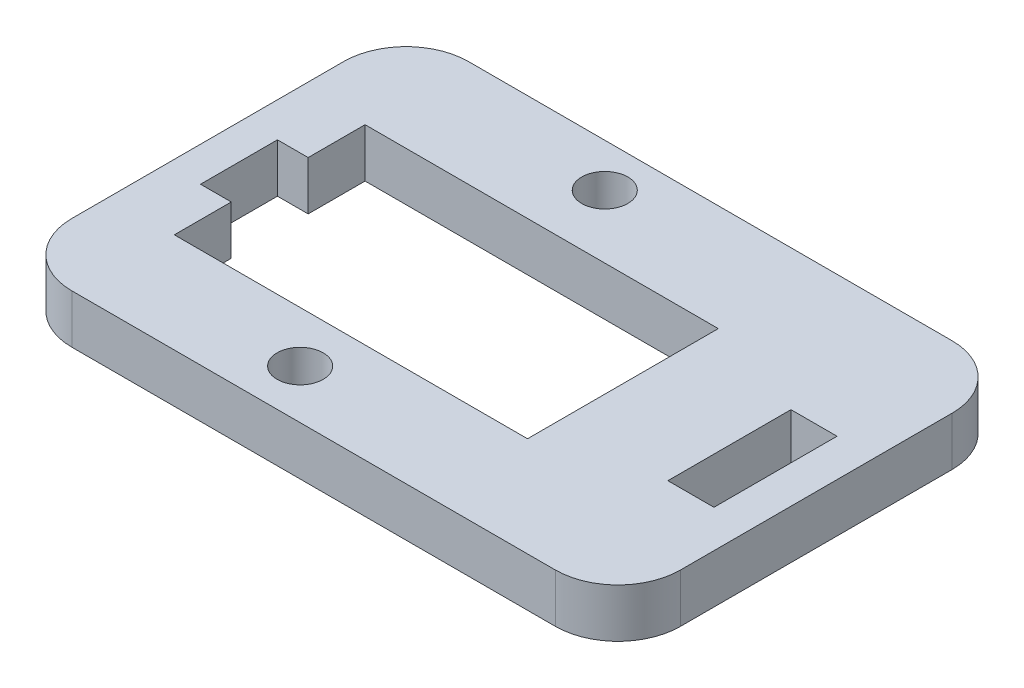
from build123d import *

# Parameters (mm, degrees)
SKETCH1_R           = 1.4972665
SKETCH1_W           = 2.994723397
SKETCH1_H           = 8.000362859
BOSS_EXTRUDE1_DEPTH = 3.175


with BuildPart() as part:
    # Sketch1 → Boss-Extrude1 (new body)
    with BuildSketch(Plane(origin=(0, 0, 0), x_dir=(1, 0, 0), z_dir=(0, 1, 0))):
        with BuildLine():
            Line((-15.724689345, 13.36466939), (15.717340342, 13.36466939))
            ThreePointArc((15.717340342, 13.36466939), (18.593486483, 12.173330652), (19.784825221, 9.297184512))
            Line((19.784825221, 9.297184512), (19.784825221, -8.374175229))
            ThreePointArc((19.784825221, -8.374175229), (18.595583797, -11.245258003), (15.724501023, -12.434499427))
            Line((15.724501023, -12.434499427), (-15.717328779, -12.434499427))
            ThreePointArc((-15.717328779, -12.434499427), (-18.593478625, -11.243159154), (-19.784818899, -8.367009308))
            Line((-19.784818899, -8.367009308), (-19.784818899, 9.304539837))
            ThreePointArc((-19.784818899, 9.304539837), (-18.595634485, 12.175484977), (-15.724689345, 13.36466939))
        make_face()
        with Locations(Location((-4.054054374, 10.549054746, 0), (0, 0, 270))):
            Circle(SKETCH1_R, mode=Mode.SUBTRACT)
        with Locations(Location((-4.054054375, -9.251582203, 0), (0, 0, 270))):
            Circle(SKETCH1_R, mode=Mode.SUBTRACT)
        Polygon((-15.533671416, 6.449054402), (7.425689399, 6.449054402), (7.425689399, -5.951480927), (-15.533671416, -5.951480927), (-15.533671416, -2.251386169), (-17.530124434, -2.251386169), (-17.530124434, 2.748832682), (-15.533671416, 2.748832682), align=None, mode=Mode.SUBTRACT)
        with Locations((15.846212781, 0.248720813)):
            Rectangle(SKETCH1_W, SKETCH1_H, mode=Mode.SUBTRACT)
    extrude(amount=BOSS_EXTRUDE1_DEPTH)


solid = part.part
